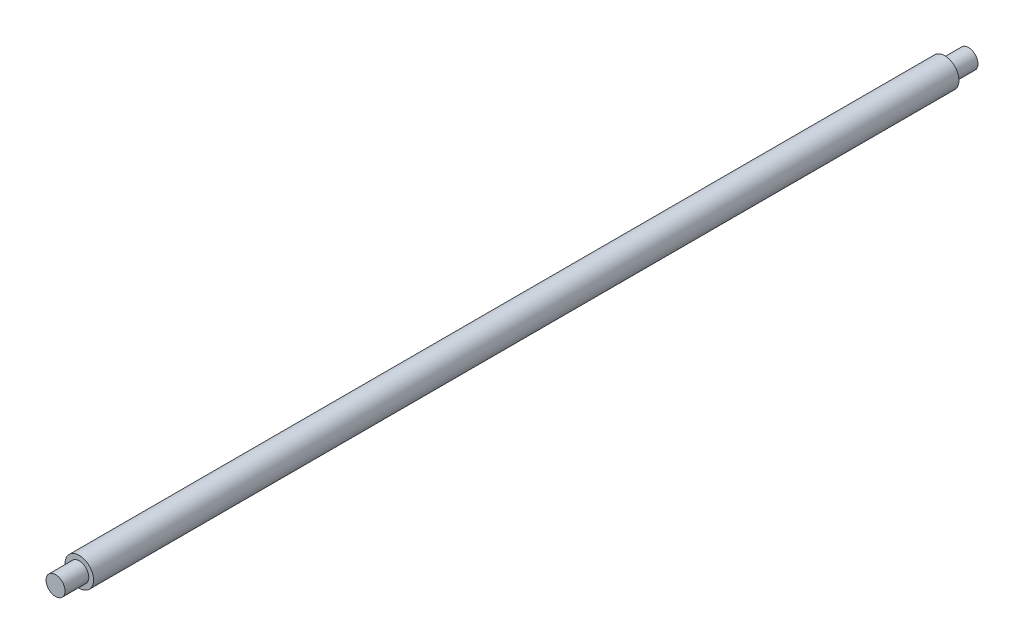
from build123d import *

# Parameters (mm, degrees)
BOSS_EXTRUDE3_DEPTH      = 596.9
BOSS_EXTRUDE3_DEPTH_BACK = 12.7
SKETCH1_R                = 6.35
BOSS_EXTRUDE4_START      = 3.175
SKETCH3_R                = 9.525
BOSS_EXTRUDE4_DEPTH      = 577.85


with BuildPart() as part:
    # Sketch1 → Boss-Extrude3 (new, two sides: drawn at the far end of the back side and taken through both)
    with BuildSketch(Plane.XY.offset(-BOSS_EXTRUDE3_DEPTH_BACK)):
        with Locations(Location((0, 0, 0), (0, 0, 270))):
            Circle(SKETCH1_R)
    extrude(amount=BOSS_EXTRUDE3_DEPTH + BOSS_EXTRUDE3_DEPTH_BACK)

    # Sketch3 → Boss-Extrude4 (add)
    with BuildSketch(Plane.XY.offset(BOSS_EXTRUDE4_START)):
        with Locations(Location((0, 0, 0), (0, 0, 180))):
            Circle(SKETCH3_R)
    extrude(amount=BOSS_EXTRUDE4_DEPTH)


solid = part.part
